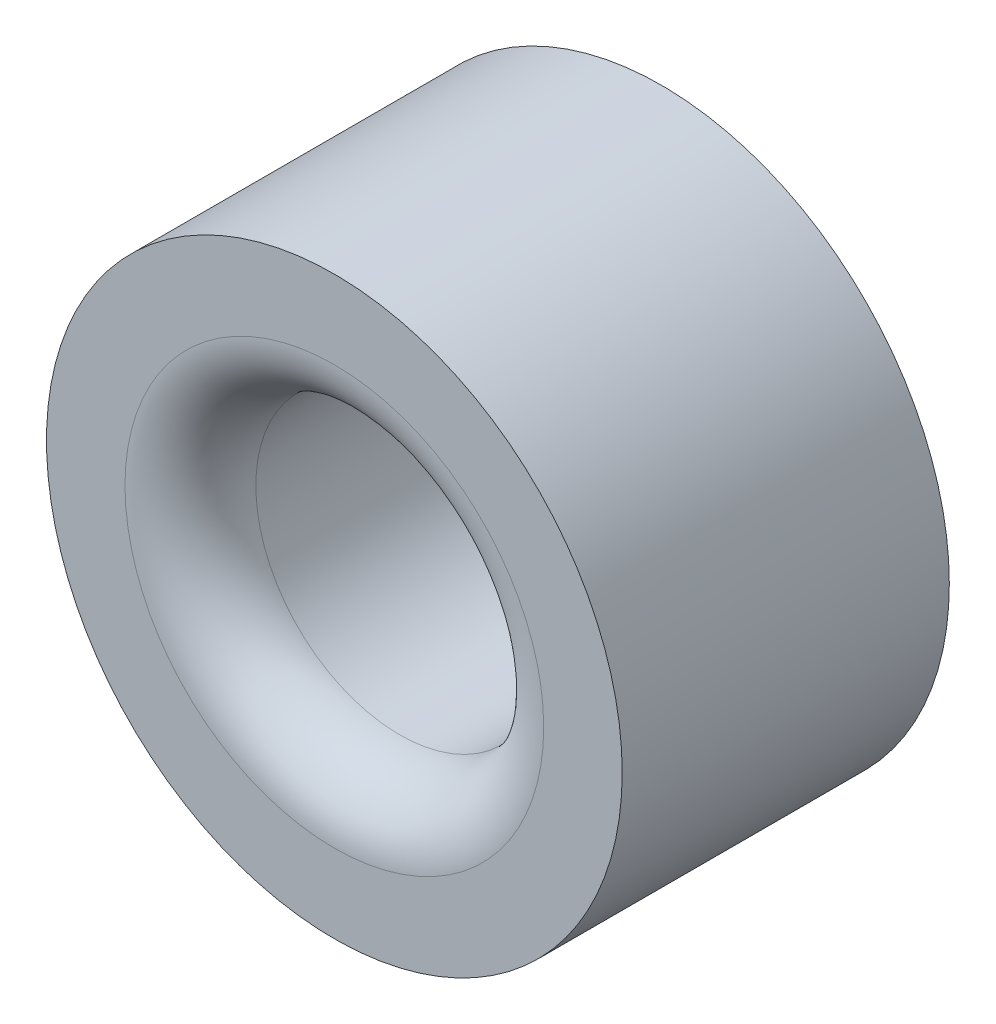
from build123d import *

# Parameters (mm, degrees)
SKETCH2_R           = 2.794
SKETCH2_R_2         = 1.397
BOSS_EXTRUDE1_DEPTH = 3.175
FILLET1_R           = 0.635


with BuildPart() as part:
    # Sketch2 → Boss-Extrude1 (new body)
    with BuildSketch(Plane.XY):
        Circle(SKETCH2_R)
        Circle(SKETCH2_R_2, mode=Mode.SUBTRACT)
    extrude(amount=BOSS_EXTRUDE1_DEPTH)

    # Fillet1
    fillet1_edges = [part.edges().sort_by_distance(p)[0] for p in [
        (-1.397, 0, 3.175),
    ]]
    fillet(fillet1_edges, radius=FILLET1_R)


solid = part.part
